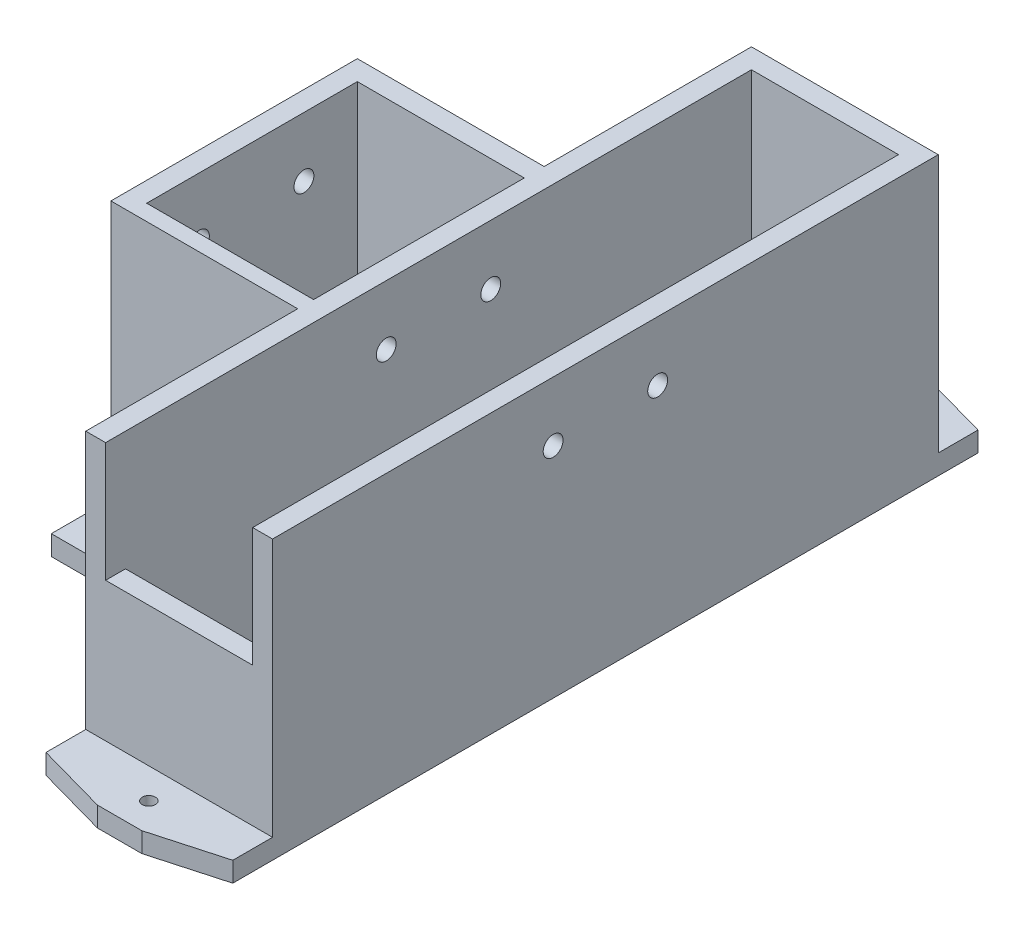
from build123d import *
from OCP.BRepFilletAPI import BRepFilletAPI_MakeChamfer

# Parameters (mm, degrees)
ESBO_O1_W                = 47
ESBO_O1_H                = 62
ESBO_O1_H_2              = 167.5
RESSALTO_EXTRUS_O1_DEPTH = 70
ESBO_O3_W                = 37
ESBO_O3_H                = 157.5
CORTE_EXTRUS_O2_DEPTH    = 65
ESBO_O5_W                = 37
ESBO_O5_H                = 31.934482306
CORTE_EXTRUS_O3_DEPTH    = 30
ESBO_O11_W               = 47
ESBO_O11_H               = 15
RESSALTO_EXTRUS_O2_DEPTH = 5
ESBO_O12_R               = 1.65
CORTE_EXTRUS_O6_DEPTH    = 138.647420971
ESBO_O14_R               = 2.5
CORTE_EXTRUS_O8_DEPTH    = 154.256525147
ESBO_O15_W               = 42
ESBO_O15_H               = 53
CORTE_EXTRUS_O10_DEPTH   = 65
CHANFRO9_SIZE            = 5
CHANFRO9_SIZE2           = 17.907987678


with BuildPart() as part:
    # Esboço1 → Ressalto-extrusão1 (new body)
    with BuildSketch(Plane(origin=(0, 0, 0), x_dir=(1, 0, 0), z_dir=(0, 1, 0))):
        with Locations((-47, 0.585067636)):
            Rectangle(ESBO_O1_W, ESBO_O1_H)
        Rectangle(ESBO_O1_W, ESBO_O1_H_2)
    extrude(amount=RESSALTO_EXTRUS_O1_DEPTH)

    # Esboço3 → Corte-extrusão2 (cut)
    with BuildSketch(Plane(origin=(0, 70, 0), x_dir=(1, 0, 0), z_dir=(0, 1, 0))):
        Rectangle(ESBO_O3_W, ESBO_O3_H)
    extrude(amount=-CORTE_EXTRUS_O2_DEPTH, mode=Mode.SUBTRACT)

    # Esboço5 → Corte-extrusão3 (cut)
    with BuildSketch(Plane(origin=(0, 70, 0), x_dir=(1, 0, 0), z_dir=(0, 1, 0))):
        with Locations((0, -78.75)):
            Rectangle(ESBO_O5_W, ESBO_O5_H)
    extrude(amount=-CORTE_EXTRUS_O3_DEPTH, mode=Mode.SUBTRACT)

    # Esboço11 → Ressalto-extrusão2 (add)
    with BuildSketch(Plane.XZ):
        with Locations((0, -91.25)):
            Rectangle(ESBO_O11_W, ESBO_O11_H)
        with Locations((0, 91.25)):
            Rectangle(ESBO_O11_W, ESBO_O11_H)
        with Locations((-47, -39.085067636)):
            Rectangle(ESBO_O11_W, ESBO_O11_H)
        with Locations((-47, 37.914932364)):
            Rectangle(ESBO_O11_W, ESBO_O11_H)
    extrude(amount=-RESSALTO_EXTRUS_O2_DEPTH)

    # Esboço12 → Corte-extrusão6 (cut, through all)
    with BuildSketch(Plane(origin=(0, 5, 0), x_dir=(1, 0, 0), z_dir=(0, 1, 0))):
        with Locations(Location((-47, -38.049932364, 0), (0, 0, 270))):
            Circle(ESBO_O12_R)
        with Locations(Location((-47, 39.215067636, 0), (0, 0, 270))):
            Circle(ESBO_O12_R)
        with Locations(Location((0, -91.38, 0), (0, 0, 270))):
            Circle(ESBO_O12_R)
        with Locations(Location((0, 91.38, 0), (0, 0, 270))):
            Circle(ESBO_O12_R)
    extrude(amount=-CORTE_EXTRUS_O6_DEPTH, mode=Mode.SUBTRACT)

    # Esboço14 → Corte-extrusão8 (cut, through all)
    with BuildSketch(Plane(origin=(23.5, 0, 0), x_dir=(0, 0, -1), z_dir=(1, 0, 0))):
        with Locations((-13.15, 55)):
            Circle(ESBO_O14_R)
        with Locations((13.15, 55)):
            Circle(ESBO_O14_R)
    extrude(amount=-CORTE_EXTRUS_O8_DEPTH, mode=Mode.SUBTRACT)

    # Esboço15 → Corte-extrusão10 (cut)
    with BuildSketch(Plane(origin=(0, 70, 0), x_dir=(1, 0, 0), z_dir=(0, 1, 0))):
        with Locations((-44.5, 0.085067636)):
            Rectangle(ESBO_O15_W, ESBO_O15_H)
    extrude(amount=-CORTE_EXTRUS_O10_DEPTH, mode=Mode.SUBTRACT)

    # Chanfro9: one chamfer whose edges measure the first distance from different faces: ONE call of the kernel's chamfer builder (chamfer() names one face for all edges)
    chanfro9_edges_1 = [part.edges().sort_by_distance(p)[0] for p in [
        (-23.5, 2.5, -98.75),
    ]]
    chanfro9_side_1 = [part.faces().sort_by_distance(p)[0] for p in [
        (-23.5, 35, -58.73896239),
    ]]
    chanfro9_edges_2 = [part.edges().sort_by_distance(p)[0] for p in [
        (23.5, 2.5, -98.75),
        (23.5, 2.5, 98.75),
    ]]
    chanfro9_side_2 = [part.faces().sort_by_distance(p)[0] for p in [
        (23.5, 34.521753359, 0),
    ]]
    chanfro9_edges_3 = [part.edges().sort_by_distance(p)[0] for p in [
        (-23.5, 2.5, 98.75),
    ]]
    chanfro9_side_3 = [part.faces().sort_by_distance(p)[0] for p in [
        (-23.5, 35, 58.153894753),
    ]]
    chanfro9 = BRepFilletAPI_MakeChamfer(part.part.solid().wrapped)
    for e in chanfro9_edges_1:
        chanfro9.Add(CHANFRO9_SIZE, CHANFRO9_SIZE2, e.wrapped, chanfro9_side_1[0].wrapped)  # the first distance lies on this face
    for e in chanfro9_edges_2:
        chanfro9.Add(CHANFRO9_SIZE, CHANFRO9_SIZE2, e.wrapped, chanfro9_side_2[0].wrapped)  # the first distance lies on this face
    for e in chanfro9_edges_3:
        chanfro9.Add(CHANFRO9_SIZE, CHANFRO9_SIZE2, e.wrapped, chanfro9_side_3[0].wrapped)  # the first distance lies on this face
    add(Compound.cast(chanfro9.Shape()), mode=Mode.REPLACE)


solid = part.part
